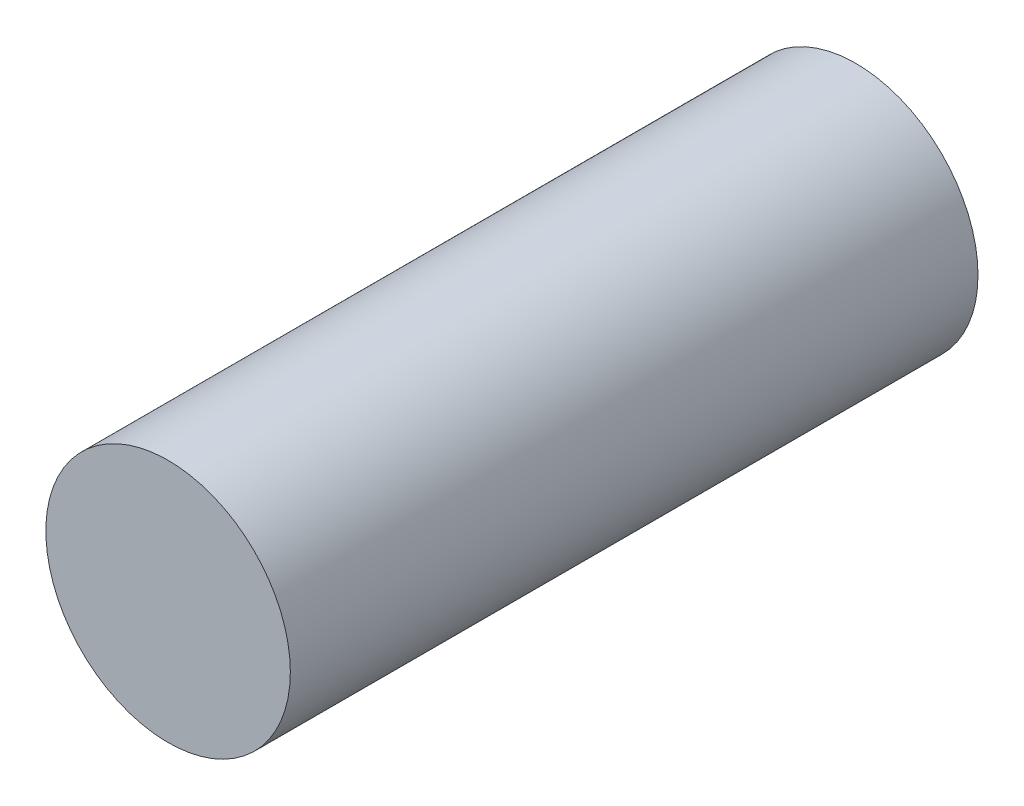
from build123d import *

# Parameters (mm, degrees)
SKETCH_1_R      = 80
EXTRUDE_1_DEPTH = 450


with BuildPart() as part:
    # 草图1 → 凸台-拉伸1 (new body)
    with BuildSketch(Plane.XY):
        Circle(SKETCH_1_R)
    extrude(amount=EXTRUDE_1_DEPTH)


solid = part.part
